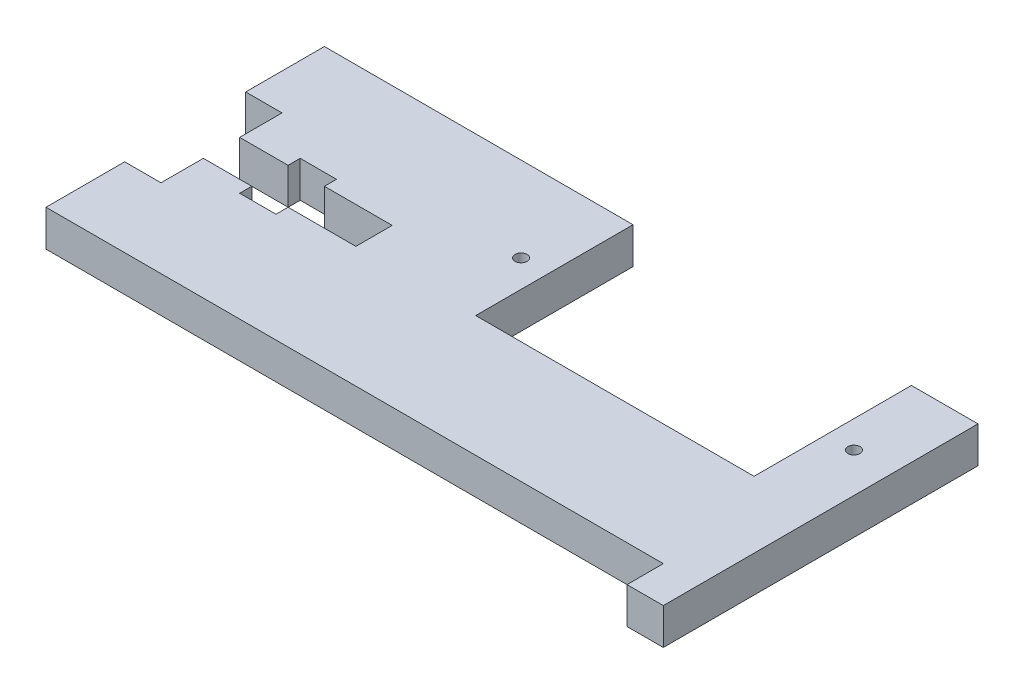
from build123d import *

# Parameters (mm, degrees)
SKETCH_1_R      = 0.5
EXTRUDE_1_DEPTH = 3


with BuildPart() as part:
    # 草图1 → 凸台-拉伸1 (new body)
    with BuildSketch(Plane(origin=(0, 0, 0), x_dir=(1, 0, 0), z_dir=(0, 1, 0))):
        Polygon((-45.982728377, 0), (-45.982728377, -6.5), (5.017271623, -6.5), (5.017271623, -9.5), (8.017271623, -9.5), (8.017271623, 16.5), (2.517271623, 16.5), (2.517271623, 3.5), (-20.482728377, 3.5), (-20.482728377, 16.5), (-45.982728377, 16.5), (-45.982728377, 10), (-42.982728377, 10), (-42.982728377, 6.5), (-38.982728377, 6.5), (-38.982728377, 7.5), (-35.982728377, 7.5), (-35.982728377, 6.5), (-30.382728377, 6.5), (-30.382728377, 3.5), (-35.982728377, 3.5), (-35.982728377, 2.5), (-38.982728377, 2.5), (-38.982728377, 3.5), (-42.982728377, 3.5), (-42.982728377, 0), align=None)
        with Locations(Location((-22.732728377, 9.5, 0), (0, 0, 270))):
            Circle(SKETCH_1_R, mode=Mode.SUBTRACT)
        with Locations(Location((4.767271623, 9.5, 0), (0, 0, 270))):
            Circle(SKETCH_1_R, mode=Mode.SUBTRACT)
    extrude(amount=EXTRUDE_1_DEPTH)


solid = part.part
